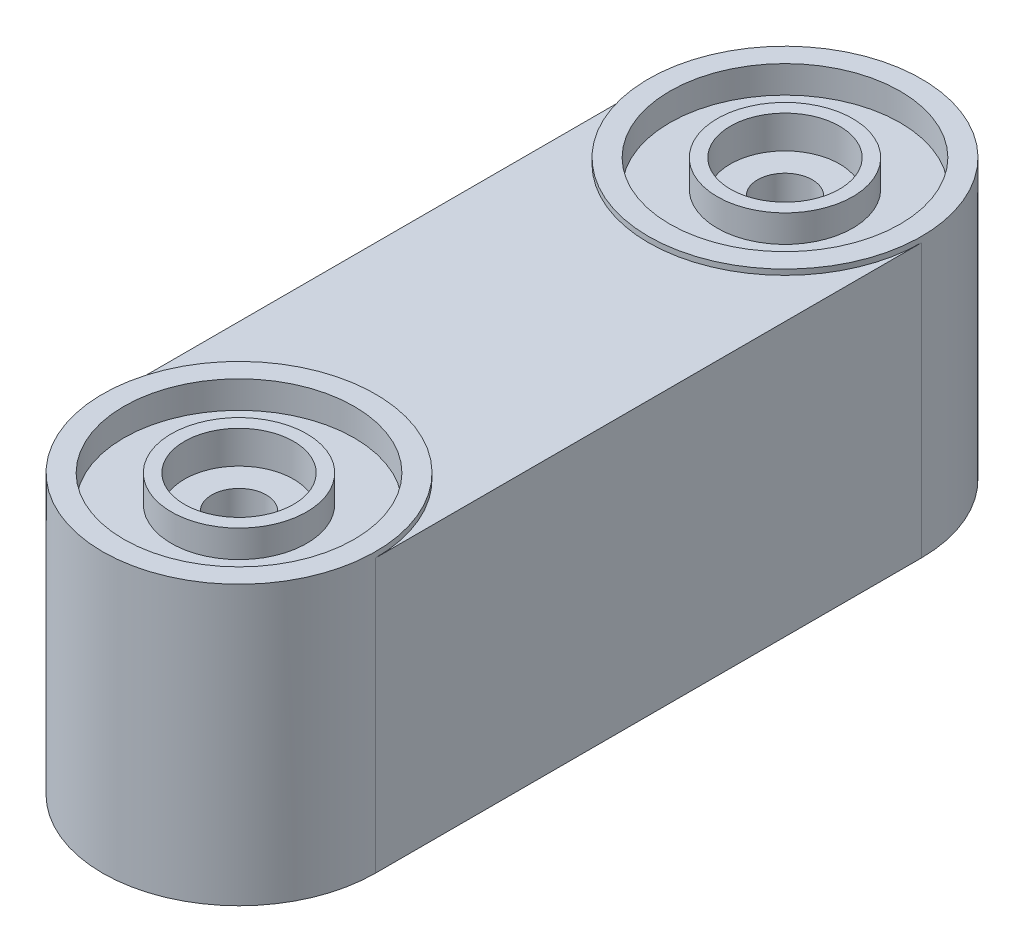
from build123d import *

# Parameters (mm, degrees)
SKIZZE1_W                       = 50
SKIZZE1_H                       = 50
AUFSATZ_LINEAR_AUSTRAGEN1_DEPTH = 150
SKIZZE2_W                       = 50
SKIZZE2_H                       = 50
AUFSATZ_LINEAR_AUSTRAGEN2_DEPTH = 1
SCHNITT_LINEAR_AUSTRAGEN1_DEPTH = 1
SCHNITT_LINEAR_AUSTRAGEN2_DEPTH = 50
SKIZZE5_R                       = 5
SCHNITT_LINEAR_AUSTRAGEN3_DEPTH = 75
SKIZZE6_R                       = 10
SCHNITT_LINEAR_AUSTRAGEN4_DEPTH = 6
SCHNITT_LINEAR_START            = -6
SKIZZE7_R                       = 10
SCHNITT_LINEAR_AUSTRAGEN5_DEPTH = 6
SKIZZE8_R                       = 21.1
SKIZZE8_R_2                     = 12.4
SCHNITT_LINEAR_AUSTRAGEN6_DEPTH = 5


with BuildPart() as part:
    # Skizze1 → Aufsatz-Linear austragen1 (new body)
    with BuildSketch(Plane.XY):
        Rectangle(SKIZZE1_W, SKIZZE1_H)
    extrude(amount=AUFSATZ_LINEAR_AUSTRAGEN1_DEPTH)

    # Skizze2 → Aufsatz-Linear austragen2 (add)
    with BuildSketch(Plane(origin=(0, 25, 0), x_dir=(1, 0, 0), z_dir=(0, 1, 0))):
        with Locations((0, -125)):
            Rectangle(SKIZZE2_W, SKIZZE2_H)
        with Locations((0, -25)):
            Rectangle(SKIZZE2_W, SKIZZE2_H)
    extrude(amount=AUFSATZ_LINEAR_AUSTRAGEN2_DEPTH)

    # Skizze3 → Schnitt-Linear austragen1 (cut)
    with BuildSketch(Plane(origin=(0, 26, 0), x_dir=(1, 0, 0), z_dir=(0, 1, 0))):
        with BuildLine():
            Line((4.2e-08, 0), (-25, 0))
            Line((-25, 0), (-25, -25))
            ThreePointArc((-25, -25), (-17.677669515, -7.322330455), (4.2e-08, 0))
        make_face()
        with BuildLine():
            Line((25, 0), (4.2e-08, 0))
            ThreePointArc((4.2e-08, 0), (17.677669545, -7.322330485), (25, -25))
            Line((25, -25), (25, 0))
        make_face()
        with BuildLine():
            ThreePointArc((0, -50), (-17.67766953, -42.67766953), (-25, -25))
            Line((-25, -25), (-25, -50))
            Line((-25, -50), (0, -50))
        make_face()
        with BuildLine():
            Line((25, -50), (25, -25))
            ThreePointArc((25, -25), (17.67766953, -42.67766953), (0, -50))
            Line((0, -50), (25, -50))
        make_face()
        with BuildLine():
            Line((-3.2e-08, -100), (-25, -100))
            Line((-25, -100), (-25, -125))
            ThreePointArc((-25, -125), (-17.677669541, -107.322330482), (-3.2e-08, -100))
        make_face()
        with BuildLine():
            Line((25, -100), (-3.2e-08, -100))
            ThreePointArc((-3.2e-08, -100), (17.677669518, -107.322330459), (25, -125))
            Line((25, -125), (25, -100))
        make_face()
        with BuildLine():
            ThreePointArc((5.8e-08, -150), (-17.677669509, -142.67766955), (-25, -125))
            Line((-25, -125), (-25, -150))
            Line((-25, -150), (5.8e-08, -150))
        make_face()
        with BuildLine():
            Line((25, -150), (25, -125))
            ThreePointArc((25, -125), (17.67766955, -142.677669509), (5.8e-08, -150))
            Line((5.8e-08, -150), (25, -150))
        make_face()
    extrude(amount=-SCHNITT_LINEAR_AUSTRAGEN1_DEPTH, mode=Mode.SUBTRACT)

    # Skizze4 → Schnitt-Linear austragen2 (cut)
    with BuildSketch(Plane(origin=(0, 25, 0), x_dir=(1, 0, 0), z_dir=(0, 1, 0))):
        with BuildLine():
            Line((25, -150), (25, -125))
            ThreePointArc((25, -125), (17.677669466, -142.677669593), (-1.79e-07, -150))
            Line((-1.79e-07, -150), (25, -150))
        make_face()
        with BuildLine():
            Line((-25, 0), (-25, -25))
            ThreePointArc((-25, -25), (-17.67766953, -7.32233047), (0, 0))
            Line((0, 0), (-25, 0))
        make_face()
        with BuildLine():
            Line((25, 0), (0, 0))
            ThreePointArc((0, 0), (17.67766953, -7.32233047), (25, -25))
            Line((25, -25), (25, 0))
        make_face()
        with BuildLine():
            ThreePointArc((-1.79e-07, -150), (-17.677669593, -142.677669466), (-25, -125))
            Line((-25, -125), (-25, -150))
            Line((-25, -150), (-1.79e-07, -150))
        make_face()
    extrude(amount=-SCHNITT_LINEAR_AUSTRAGEN2_DEPTH, mode=Mode.SUBTRACT)

    # Skizze5 → Schnitt-Linear austragen3 (cut)
    with BuildSketch(Plane(origin=(0, 26, 0), x_dir=(1, 0, 0), z_dir=(0, 1, 0))):
        with Locations((0, -25)):
            Circle(SKIZZE5_R)
        with Locations((0, -125)):
            Circle(SKIZZE5_R)
    extrude(amount=-SCHNITT_LINEAR_AUSTRAGEN3_DEPTH, mode=Mode.SUBTRACT)

    # Skizze6 → Schnitt-Linear austragen4 (cut)
    with BuildSketch(Plane(origin=(0, 26, 0), x_dir=(1, 0, 0), z_dir=(0, 1, 0))):
        with Locations((0, -125)):
            Circle(SKIZZE6_R)
        with Locations((0, -25)):
            Circle(SKIZZE6_R)
    extrude(amount=-SCHNITT_LINEAR_AUSTRAGEN4_DEPTH, mode=Mode.SUBTRACT)

    # Skizze7 → Schnitt-Linear austragen5 (cut)
    with BuildSketch(Plane.XZ.offset(25).offset(SCHNITT_LINEAR_START)):
        with Locations((0, 125)):
            Circle(SKIZZE7_R)
        with Locations((0, 25)):
            Circle(SKIZZE7_R)
    extrude(amount=SCHNITT_LINEAR_AUSTRAGEN5_DEPTH, mode=Mode.SUBTRACT)

    # Skizze8 → Schnitt-Linear austragen6 (cut)
    # profile 1 of 2: a face of its own
    with BuildSketch(Plane(origin=(0, 26, 0), x_dir=(1, 0, 0), z_dir=(0, 1, 0))):
        with Locations((0, -25)):
            Circle(SKIZZE8_R)
        with Locations((0, -25)):
            Circle(SKIZZE8_R_2, mode=Mode.SUBTRACT)
    # profile 2 of 2: a face of its own
    with BuildSketch(Plane(origin=(0, 26, 0), x_dir=(1, 0, 0), z_dir=(0, 1, 0))):
        with Locations((0, -125)):
            Circle(SKIZZE8_R)
        with Locations((0, -125)):
            Circle(SKIZZE8_R_2, mode=Mode.SUBTRACT)
    extrude(amount=-SCHNITT_LINEAR_AUSTRAGEN6_DEPTH, mode=Mode.SUBTRACT)


solid = part.part
